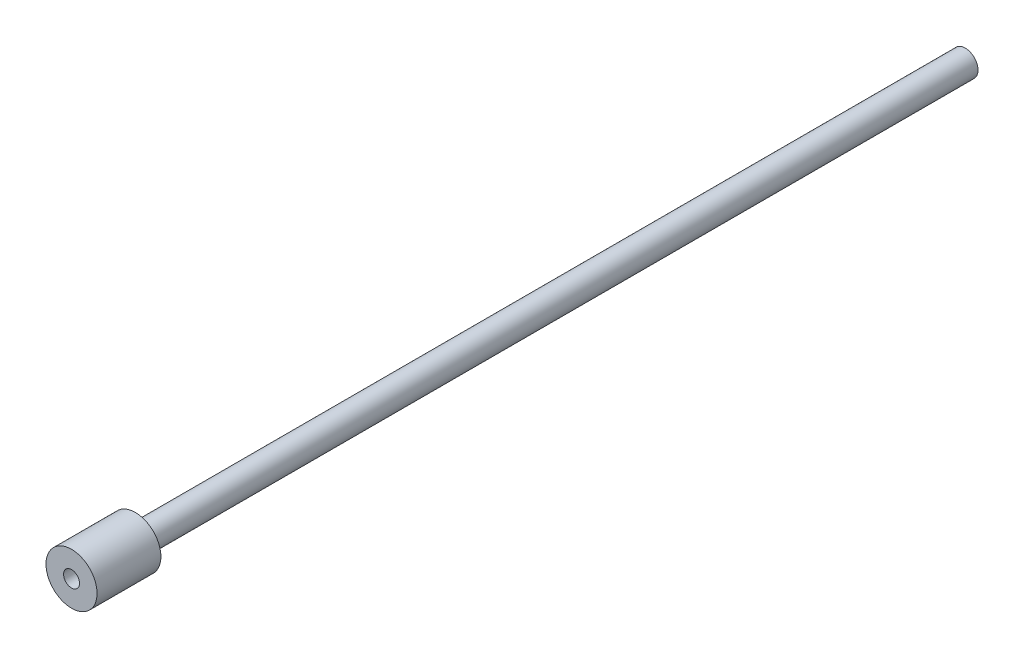
from build123d import *


with BuildPart() as part:
    # Sketch1 → Revolve1 (revolve)
    with BuildSketch(Plane(origin=(0, 0, 0), x_dir=(1, 0, 0), z_dir=(0, 1, 0)), mode=Mode.PRIVATE) as revolve1_sk:
        Polygon((2.5, 0), (8, 0), (8, 20), (4, 20), (4, 279.995833301), (0, 279.995833301), (0, 10), (2.5, 10), align=None)
    revolve(revolve1_sk.sketch.rotate(Axis((0, 0, -279.995833301), (0, 0, 1)), 180), axis=Axis((0, 0, -279.995833301), (0, 0, 1)))


solid = part.part
